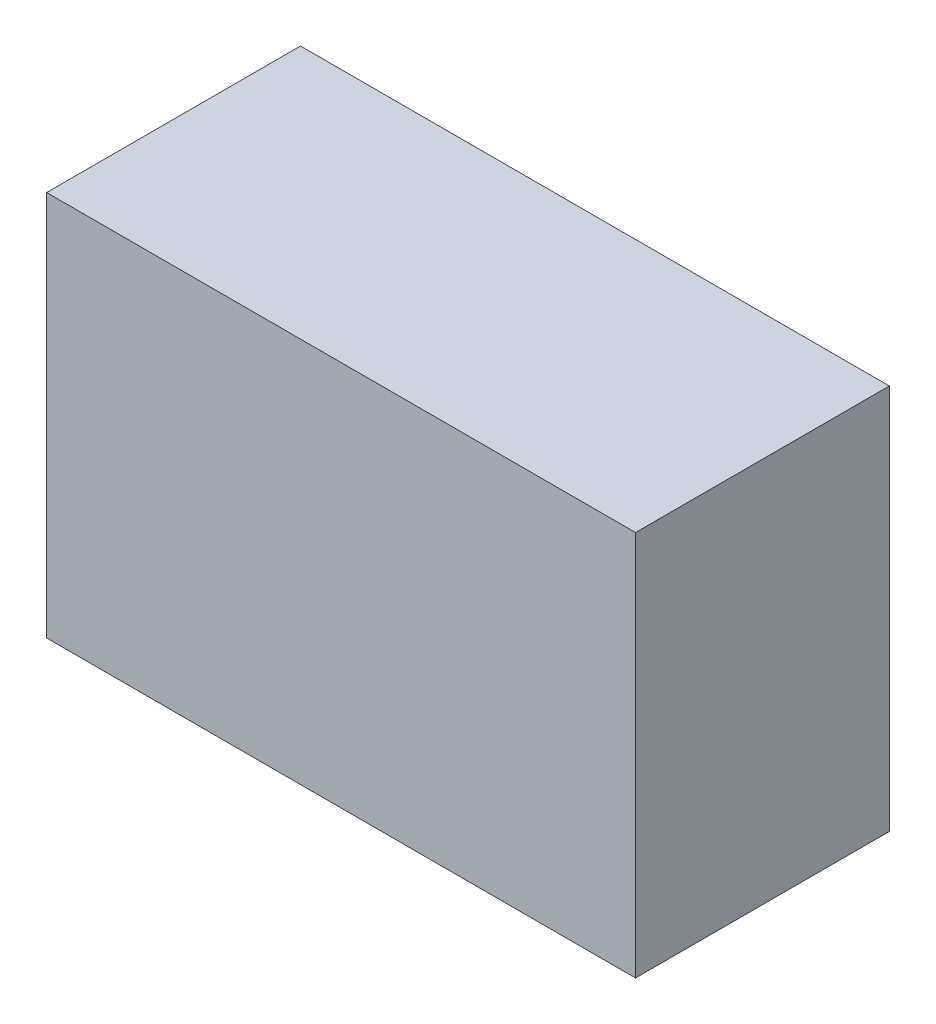
from build123d import *

# Parameters (mm, degrees)
SKETCH1_W           = 2.9
SKETCH1_H           = 1.9
BOSS_EXTRUDE1_DEPTH = 1.25


with BuildPart() as part:
    # Sketch1 → Boss-Extrude1 (new body)
    with BuildSketch(Plane.XY):
        Rectangle(SKETCH1_W, SKETCH1_H)
    extrude(amount=BOSS_EXTRUDE1_DEPTH)


solid = part.part
